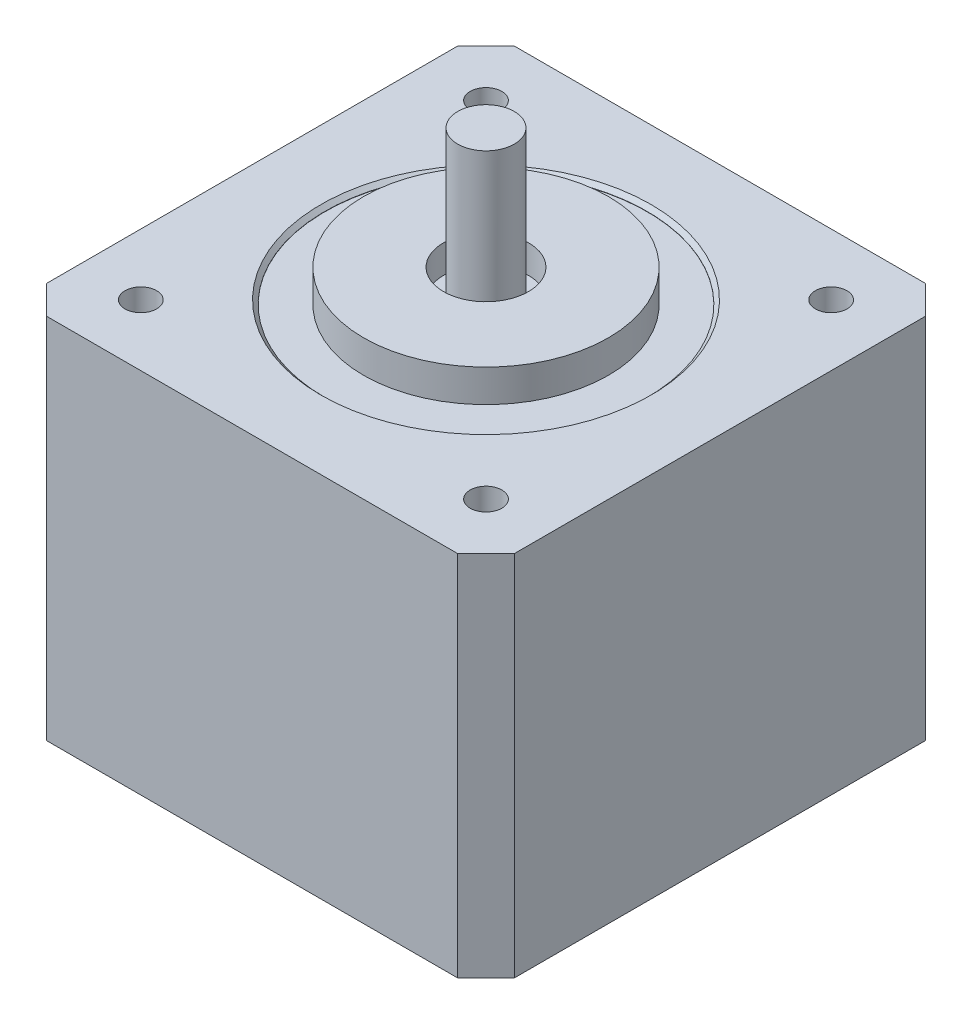
from build123d import *

# Parameters (mm, degrees)
SKETCH1_W           = 42.037
SKETCH1_H           = 42.037
BOSS_EXTRUDE1_DEPTH = 33.02
CHAMFER1_SIZE       = 2.54
SKETCH2_R           = 10.9982
SKETCH2_R_2         = 3.81
BOSS_EXTRUDE2_DEPTH = 2.54
CUT_EXTRUDE1_START  = -0.381
SKETCH3_R           = 14.478
SKETCH3_R_2         = 10.9982
CUT_EXTRUDE1_DEPTH  = 0.381
CHAMFER2_SIZE       = 0.3556
SKETCH4_R           = 2.54
BOSS_EXTRUDE3_DEPTH = 13.3858
SKETCH5_R           = 1.4224
CUT_EXTRUDE2_DEPTH  = 45.428313996


with BuildPart() as part:
    # Sketch1 → Boss-Extrude1 (new body)
    with BuildSketch(Plane(origin=(0, 0, 0), x_dir=(1, 0, 0), z_dir=(0, 1, 0))):
        Rectangle(SKETCH1_W, SKETCH1_H)
    extrude(amount=BOSS_EXTRUDE1_DEPTH)

    # Chamfer1
    chamfer1_edges = [part.edges().sort_by_distance(p)[0] for p in [
        (21.0185, 16.51, 21.0185),
        (-21.0185, 16.51, 21.0185),
        (-21.0185, 16.51, -21.0185),
        (21.0185, 16.51, -21.0185),
    ]]
    chamfer(chamfer1_edges, length=CHAMFER1_SIZE)

    # Sketch2 → Boss-Extrude2 (add)
    with BuildSketch(Plane(origin=(0, 33.02, 0), x_dir=(1, 0, 0), z_dir=(0, 1, 0))):
        with Locations(Location((0, 0, 0), (0, 0, 90))):
            Circle(SKETCH2_R)
        with Locations(Location((0, 0, 0), (0, 0, 270))):
            Circle(SKETCH2_R_2, mode=Mode.SUBTRACT)
    extrude(amount=BOSS_EXTRUDE2_DEPTH)

    # Sketch3 → Cut-Extrude1 (cut)
    with BuildSketch(Plane(origin=(0, 33.02, 0), x_dir=(1, 0, 0), z_dir=(0, 1, 0)).offset(CUT_EXTRUDE1_START)):
        with Locations(Location((0, 0, 0), (0, 0, 270))):
            Circle(SKETCH3_R)
        with Locations(Location((0, 0, 0), (0, 0, 270))):
            Circle(SKETCH3_R_2, mode=Mode.SUBTRACT)
    extrude(amount=CUT_EXTRUDE1_DEPTH, mode=Mode.SUBTRACT)

    # Chamfer2
    chamfer2_edges = [part.edges().sort_by_distance(p)[0] for p in [
        (0, 33.02, -14.478),
    ]]
    chamfer(chamfer2_edges, length=CHAMFER2_SIZE)

    # Sketch4 → Boss-Extrude3 (add)
    with BuildSketch(Plane(origin=(0, 33.02, 0), x_dir=(1, 0, 0), z_dir=(0, 1, 0))):
        with Locations(Location((0, 0, 0), (0, 0, 90))):
            Circle(SKETCH4_R)
    extrude(amount=BOSS_EXTRUDE3_DEPTH)

    # Sketch5 → Cut-Extrude2 (cut, through all)
    with BuildSketch(Plane(origin=(0, 33.02, 0), x_dir=(1, 0, 0), z_dir=(0, 1, 0))):
        with Locations(Location((-15.5067, 15.5067, 0), (0, 0, 270))):
            Circle(SKETCH5_R)
        with Locations(Location((15.5067, 15.5067, 0), (0, 0, 270))):
            Circle(SKETCH5_R)
        with Locations(Location((-15.5067, -15.5067, 0), (0, 0, 270))):
            Circle(SKETCH5_R)
        with Locations(Location((15.5067, -15.5067, 0), (0, 0, 270))):
            Circle(SKETCH5_R)
    extrude(amount=-CUT_EXTRUDE2_DEPTH, mode=Mode.SUBTRACT)


solid = part.part
